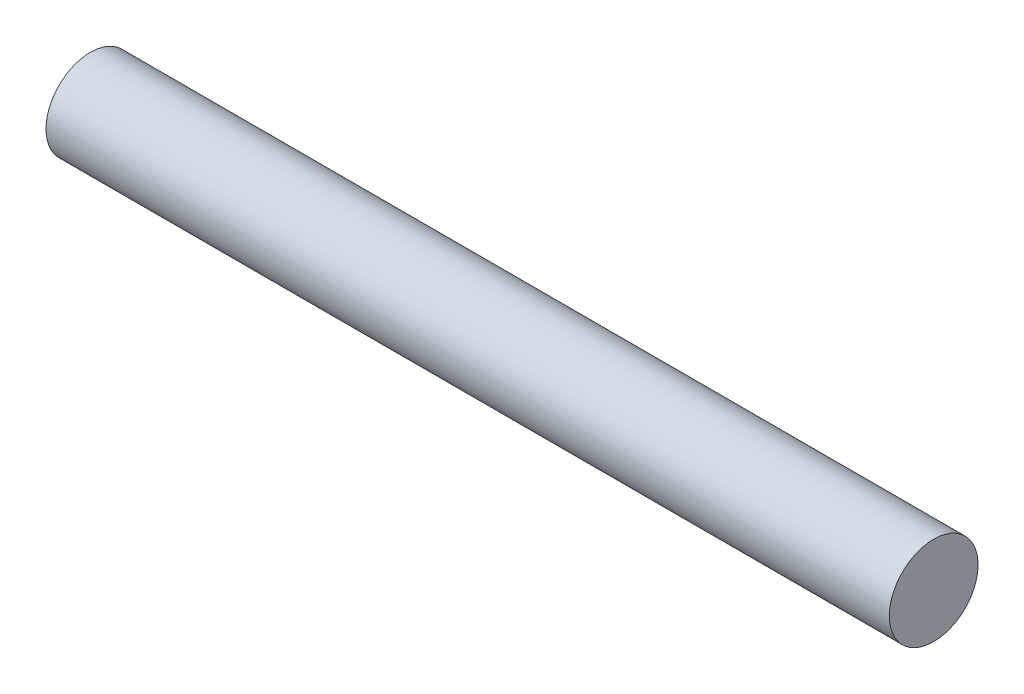
from build123d import *

# Parameters (mm, degrees)
SKETCH_1_W = 114
SKETCH_1_H = 6


with BuildPart() as part:
    # 草图1 → 旋转1 (revolve)
    with BuildSketch(Plane.XY, mode=Mode.PRIVATE) as revolve_1_sk:
        with Locations((57, 3)):
            Rectangle(SKETCH_1_W, SKETCH_1_H)
    revolve(revolve_1_sk.sketch.rotate(Axis((0, 0, 0), (1, 0, 0)), 90), axis=Axis((0, 0, 0), (1, 0, 0)))


solid = part.part
